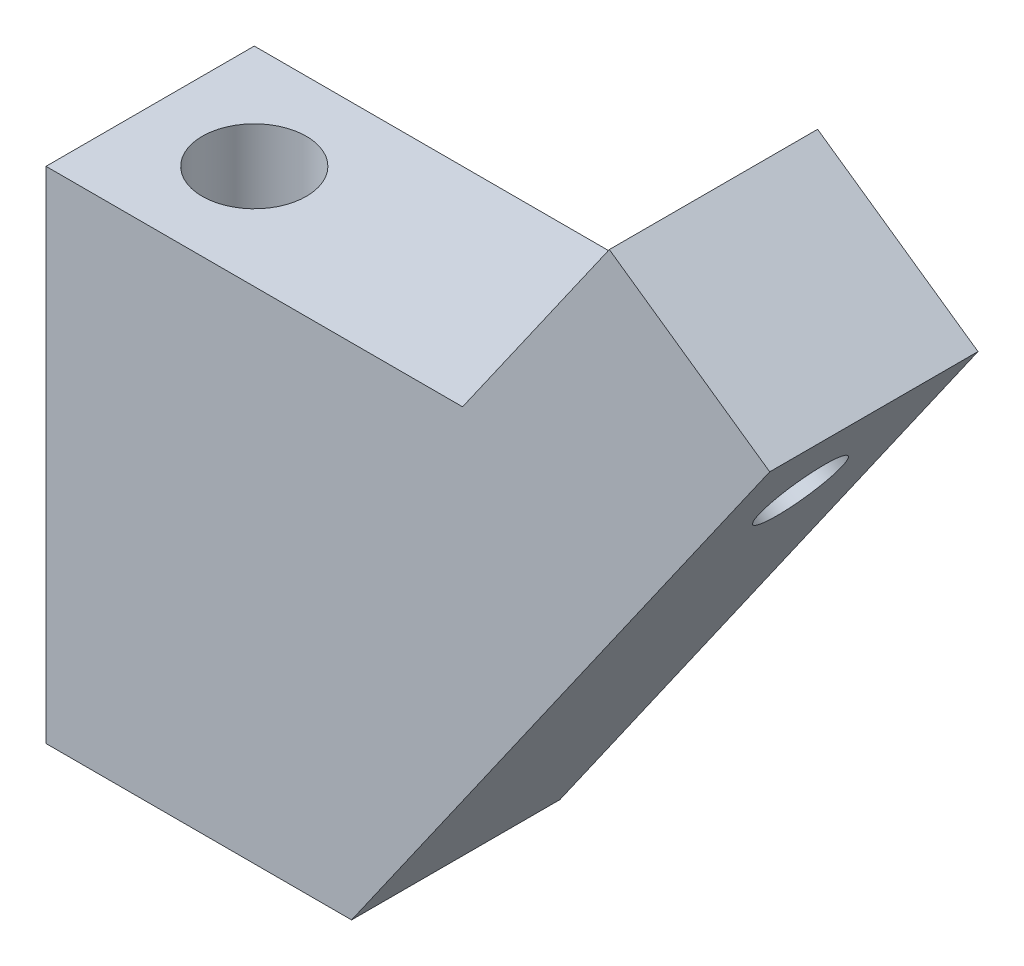
from build123d import *

# Parameters (mm, degrees)
BOSS_EXTRUDE2_DEPTH = 12.7
SKETCH2_R           = 2.54
CUT_EXTRUDE1_DEPTH  = 11.938
SKETCH3_R           = 3.175
CUT_EXTRUDE4_DEPTH  = 30.48


with BuildPart() as part:
    # Sketch1 → Boss-Extrude2 (new body)
    with BuildSketch(Plane.XY):
        Polygon((25.4, 30.48), (34.347716767, 43.258663866), (44.126753872, 36.411308369), (18.631281276, 0), (0, 0), (0, 30.48), align=None)
    extrude(amount=BOSS_EXTRUDE2_DEPTH)

    # Sketch2 → Cut-Extrude1 (cut)
    with BuildSketch(Plane(origin=(2.722740279, -1.906483268, 0), x_dir=(0, 0, 1), z_dir=(-0.8191520442889891, 0.5735764363510498, 0))):
        with Locations(Location((6.35, 47.336529856, 0), (0, 0, 270))):
            Circle(SKETCH2_R)
    extrude(amount=-CUT_EXTRUDE1_DEPTH, mode=Mode.SUBTRACT)

    # Sketch3 → Cut-Extrude4 (cut)
    with BuildSketch(Plane(origin=(0, 30.48, 0), x_dir=(1, 0, 0), z_dir=(0, 1, 0))):
        with Locations(Location((6.35, -6.35, 0), (0, 0, 270))):
            Circle(SKETCH3_R)
    extrude(amount=-CUT_EXTRUDE4_DEPTH, mode=Mode.SUBTRACT)


solid = part.part
